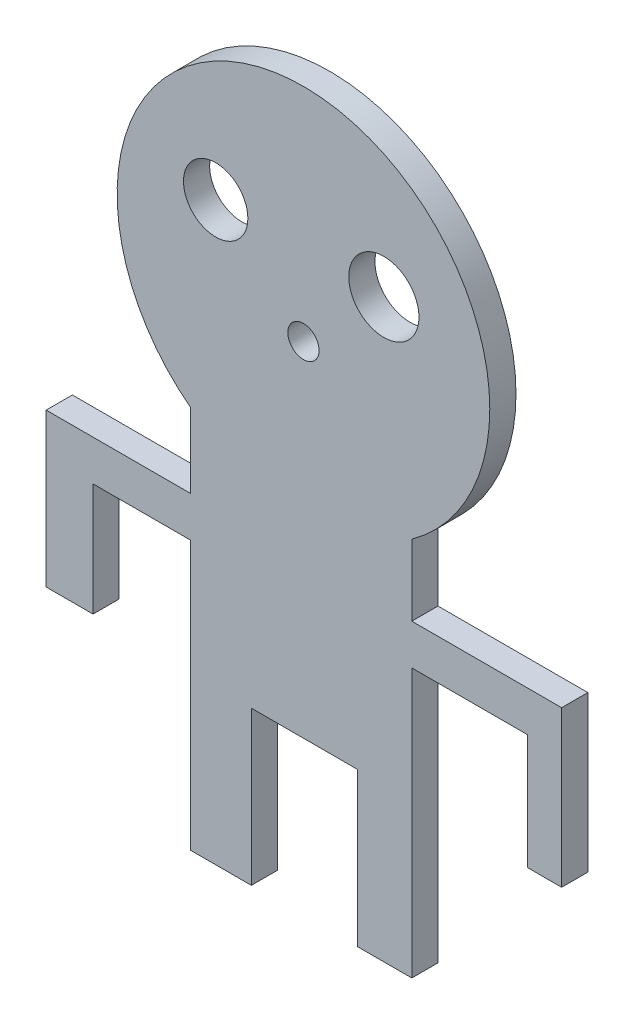
from build123d import *

# Parameters (mm, degrees)
SKETCH1_R           = 12.288018633
SKETCH1_R_2         = 13.402342443
SKETCH1_R_3         = 5.966655134
BOSS_EXTRUDE1_DEPTH = 10


with BuildPart() as part:
    # Sketch1 → Boss-Extrude1 (new body)
    with BuildSketch(Plane.XY):
        with BuildLine():
            Line((-43.16670826, -100.459006624), (-43.16670826, -144.386357681))
            Line((-43.16670826, -144.386357681), (-43.16670826, -202.977586365))
            Line((-43.16670826, -202.977586365), (-19.89608029, -202.977586365))
            Line((-19.89608029, -202.977586365), (-19.89608029, -144.386357681))
            Line((-19.89608029, -144.386357681), (20.715262102, -144.386357681))
            Line((20.715262102, -144.386357681), (20.715262102, -202.977586365))
            Line((20.715262102, -202.977586365), (41.349988273, -202.977586365))
            Line((41.349988273, -202.977586365), (41.349988273, -144.386357681))
            Line((41.349988273, -144.386357681), (41.349988273, -100.459006624))
            Line((41.349988273, -100.459006624), (85.500022586, -100.459006624))
            Line((85.500022586, -100.459006624), (85.500022586, -144.386357681))
            Line((85.500022586, -144.386357681), (98.553668355, -144.386357681))
            Line((98.553668355, -144.386357681), (98.553668355, -100.459006624))
            Line((98.553668355, -100.459006624), (98.553668355, -85.011306082))
            Line((98.553668355, -85.011306082), (41.349988273, -85.011306082))
            Line((41.349988273, -85.011306082), (41.349988273, -57.873752711))
            ThreePointArc((41.349988273, -57.873752711), (1.129346742, 71.119036544), (-43.16670826, -56.531655566))
            Line((-43.16670826, -56.531655566), (-43.16670826, -85.011306082))
            Line((-43.16670826, -85.011306082), (-98.217954904, -85.011306082))
            Line((-98.217954904, -85.011306082), (-98.217954904, -100.459006624))
            Line((-98.217954904, -100.459006624), (-98.217954904, -143.510977861))
            Line((-98.217954904, -143.510977861), (-80.329625517, -143.510977861))
            Line((-80.329625517, -143.510977861), (-80.329625517, -100.459006624))
            Line((-80.329625517, -100.459006624), (-43.16670826, -100.459006624))
        make_face()
        with Locations((-33.517420804, 16.851364033)):
            Circle(SKETCH1_R, mode=Mode.SUBTRACT)
        with Locations((30.688490145, 16.851364033)):
            Circle(SKETCH1_R_2, mode=Mode.SUBTRACT)
        with Locations((0, -13.237752907)):
            Circle(SKETCH1_R_3, mode=Mode.SUBTRACT)
    extrude(amount=BOSS_EXTRUDE1_DEPTH)


solid = part.part
